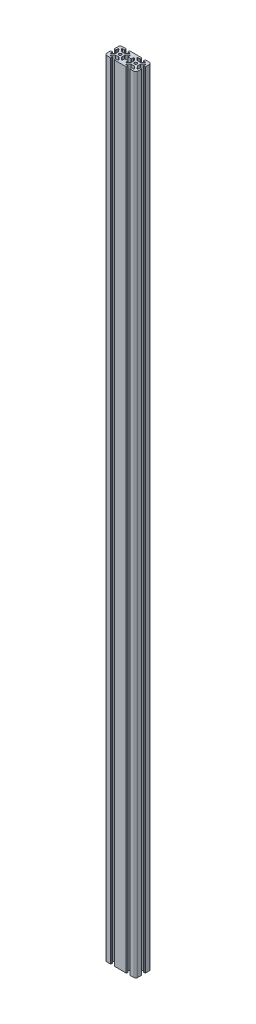
from build123d import *

# Parameters (mm, degrees)
BOSS_EXTRUDE1_DEPTH   = 2016
SKETCH3_R             = 3.4
CUT_EXTRUDE1_DEPTH    = 2018.983151565
CUT_EXTRUDE2_DEPTH    = 2018.983151565
FILLET1_R             = 1
FILLET2_R             = 1
FILLET3_R             = 1
CUT_EXTRUDE3_DEPTH    = 2018.983151565
CUT_EXTRUDE4_DEPTH    = 2018.983151565
FILLET4_R             = 1
FILLET5_R             = 1
FILLET6_R             = 1
FILLET7_R             = 1
FILLET8_R             = 1
FILLET9_R             = 1
FILLET10_R            = 1
FILLET11_R            = 1
MIRROR11_COPY_1_DEPTH = 2018.983151565
MIRROR11_COPY_2_DEPTH = 2018.983151565
CUT_EXTRUDE5_DEPTH    = 1000


with BuildPart() as part:
    # Sketch1 → Boss-Extrude1 (new body)
    with BuildSketch(Plane(origin=(0, 0, 0), x_dir=(1, 0, 0), z_dir=(0, 1, 0))):
        with BuildLine():
            Line((5, 0), (75, 0))
            ThreePointArc((75, 0), (78.535533906, -1.464466094), (80, -5))
            Line((80, -5), (80, -35))
            ThreePointArc((80, -35), (78.535533906, -38.535533906), (75, -40))
            Line((75, -40), (5, -40))
            ThreePointArc((5, -40), (1.464466094, -38.535533906), (0, -35))
            Line((0, -35), (0, -5))
            ThreePointArc((0, -5), (1.464466094, -1.464466094), (5, 0))
        make_face()
    extrude(amount=BOSS_EXTRUDE1_DEPTH)

    # Sketch3 → Cut-Extrude1 (cut, through all)
    with BuildSketch(Plane(origin=(0, 2016, 0), x_dir=(1, 0, 0), z_dir=(0, 1, 0))):
        with Locations(Location((20, -20, 0), (0, 0, 270))):
            Circle(SKETCH3_R)
    cut_extrude1 = extrude(amount=-CUT_EXTRUDE1_DEPTH, mode=Mode.SUBTRACT)

    # Mirror3: Cut-Extrude1 across plane
    add(cut_extrude1.mirror(Plane(origin=(40, 0, 0), x_dir=(0, 0, 1), z_dir=(1, 0, 0))), mode=Mode.SUBTRACT)

    # Sketch7 → Cut-Extrude2 (cut, through all)
    with BuildSketch(Plane(origin=(0, 0, 0), x_dir=(-1, 0, 0), z_dir=(0, -1, 0))):
        with BuildLine():
            Line((-15.9, -40), (-24.1, -40))
            Line((-24.1, -40), (-24.1, -36.5))
            ThreePointArc((-24.1, -36.5), (-24.392893219, -35.792893219), (-25.1, -35.5))
            Line((-25.1, -35.5), (-29.489753594, -35.5))
            ThreePointArc((-29.489753594, -35.5), (-30.415270825, -34.8787055), (-30.190750526, -33.786835712))
            Line((-30.190750526, -33.786835712), (-24.391814382, -28.086835712))
            ThreePointArc((-24.391814382, -28.086835712), (-24.069522951, -27.874482769), (-23.69081745, -27.8))
            Line((-23.69081745, -27.8), (-16.309186536, -27.8))
            ThreePointArc((-16.309186536, -27.8), (-15.930477876, -27.874484063), (-15.608184734, -28.086840499))
            Line((-15.608184734, -28.086840499), (-9.809327805, -33.786840499))
            ThreePointArc((-9.809327805, -33.786840499), (-9.584813669, -34.87870866), (-10.510329607, -35.5))
            Line((-10.510329607, -35.5), (-14.9, -35.5))
            ThreePointArc((-14.9, -35.5), (-15.607106781, -35.792893219), (-15.9, -36.5))
            Line((-15.9, -36.5), (-15.9, -40))
        make_face()
    cut_extrude2 = extrude(amount=-CUT_EXTRUDE2_DEPTH, mode=Mode.SUBTRACT)

    # Fillet1
    fillet1_edges = [part.edges().sort_by_distance(p)[0] for p in [
        (15.9, 1008, 40),
        (24.1, 1008, 40),
    ]]
    fillet(fillet1_edges, radius=FILLET1_R)

    # Mirror8: Cut-Extrude2 across plane
    add(cut_extrude2.mirror(Plane(origin=(40, 0, 0), x_dir=(0, 0, 1), z_dir=(1, 0, 0))), mode=Mode.SUBTRACT)

    # Fillet2
    fillet2_edges = [part.edges().sort_by_distance(p)[0] for p in [
        (55.9, 1008, 40),
    ]]
    fillet(fillet2_edges, radius=FILLET2_R)

    # Fillet3
    fillet3_edges = [part.edges().sort_by_distance(p)[0] for p in [
        (64.1, 1008, 40),
    ]]
    fillet(fillet3_edges, radius=FILLET3_R)

    # Sketch9 → Cut-Extrude3 (cut, through all)
    with BuildSketch(Plane(origin=(0, 0, 0), x_dir=(1, 0, 0), z_dir=(0, 1, 0))):
        with BuildLine():
            Line((14.899846923, -4.500713815), (10.450461284, -4.500713815))
            ThreePointArc((10.450461284, -4.500713815), (9.526581751, -5.118030383), (9.743354502, -6.207820596))
            Line((9.743354502, -6.207820596), (15.442640687, -11.907106781))
            ThreePointArc((15.442640687, -11.907106781), (15.767064036, -12.123879533), (16.149747468, -12.2))
            Line((16.149747468, -12.2), (23.850252532, -12.2))
            ThreePointArc((23.850252532, -12.2), (24.232935964, -12.123879533), (24.557359313, -11.907106781))
            Line((24.557359313, -11.907106781), (30.257359313, -6.207106781))
            ThreePointArc((30.257359313, -6.207106781), (30.474132064, -5.117316568), (29.550252532, -4.5))
            Line((29.550252532, -4.5), (25.099846964, -4.5))
            ThreePointArc((25.099846964, -4.5), (24.392724723, -4.207091321), (24.099846965, -3.499956273))
            Line((24.099846965, -3.499956273), (24.100000008, 0))
            Line((24.100000008, 0), (15.9, 0))
            Line((15.9, 0), (15.899846922, -3.500757542))
            ThreePointArc((15.899846922, -3.500757542), (15.606938244, -4.207836056), (14.899846923, -4.500713815))
        make_face()
    cut_extrude3 = extrude(amount=CUT_EXTRUDE3_DEPTH, mode=Mode.SUBTRACT)

    # Mirror9: Cut-Extrude3 across plane
    add(cut_extrude3.mirror(Plane(origin=(40, 0, 0), x_dir=(0, 0, 1), z_dir=(1, 0, 0))), mode=Mode.SUBTRACT)

    # Sketch10 → Cut-Extrude4 (cut, through all)
    with BuildSketch(Plane(origin=(0, 0, 0), x_dir=(1, 0, 0), z_dir=(0, 1, 0))):
        with BuildLine():
            Line((4.5, -14.9), (4.5, -10.58605332))
            ThreePointArc((4.5, -10.58605332), (5.126159695, -9.658560233), (6.220486853, -9.892584724))
            Line((6.220486853, -9.892584724), (11.920486853, -15.814662646))
            ThreePointArc((11.920486853, -15.814662646), (12.127493087, -16.134290938), (12.2, -16.508131242))
            Line((12.2, -16.508131242), (12.2, -23.491868758))
            ThreePointArc((12.2, -23.491868758), (12.127493087, -23.865709062), (11.920486853, -24.185337354))
            Line((11.920486853, -24.185337354), (6.220486853, -30.107415276))
            ThreePointArc((6.220486853, -30.107415276), (5.126159695, -30.341439767), (4.5, -29.41394668))
            Line((4.5, -29.41394668), (4.5, -25.1))
            ThreePointArc((4.5, -25.1), (4.207106781, -24.392893219), (3.5, -24.1))
            Line((3.5, -24.1), (0, -24.1))
            Line((0, -24.1), (0, -15.9))
            Line((0, -15.9), (3.5, -15.9))
            ThreePointArc((3.5, -15.9), (4.207106781, -15.607106781), (4.5, -14.9))
        make_face()
    cut_extrude4 = extrude(amount=CUT_EXTRUDE4_DEPTH, mode=Mode.SUBTRACT)

    # Fillet4
    fillet4_edges = [part.edges().sort_by_distance(p)[0] for p in [
        (24.100000008, 1008, 0),
    ]]
    fillet(fillet4_edges, radius=FILLET4_R)

    # Fillet5
    fillet5_edges = [part.edges().sort_by_distance(p)[0] for p in [
        (64.1, 1008, 0),
    ]]
    fillet(fillet5_edges, radius=FILLET5_R)

    # Fillet6
    fillet6_edges = [part.edges().sort_by_distance(p)[0] for p in [
        (55.899999992, 1008, 0),
    ]]
    fillet(fillet6_edges, radius=FILLET6_R)

    # Fillet7
    fillet7_edges = [part.edges().sort_by_distance(p)[0] for p in [
        (15.9, 1008, 0),
    ]]
    fillet(fillet7_edges, radius=FILLET7_R)

    # Fillet8
    fillet8_edges = [part.edges().sort_by_distance(p)[0] for p in [
        (0, 1008, 24.1),
    ]]
    fillet(fillet8_edges, radius=FILLET8_R)

    # Fillet9
    fillet9_edges = [part.edges().sort_by_distance(p)[0] for p in [
        (0, 1008, 15.9),
    ]]
    fillet(fillet9_edges, radius=FILLET9_R)

    # Mirror10: Cut-Extrude4 across plane
    add(cut_extrude4.mirror(Plane(origin=(40, 0, 0), x_dir=(0, 0, 1), z_dir=(1, 0, 0))), mode=Mode.SUBTRACT)

    # Fillet10
    fillet10_edges = [part.edges().sort_by_distance(p)[0] for p in [
        (80, 1008, 15.9),
    ]]
    fillet(fillet10_edges, radius=FILLET10_R)

    # Fillet11
    fillet11_edges = [part.edges().sort_by_distance(p)[0] for p in [
        (80, 1008, 24.1),
    ]]
    fillet(fillet11_edges, radius=FILLET11_R)

    # Mirror11 copy 1 sketch → Mirror11 copy 1 (cut, through all)
    with BuildSketch(Plane(origin=(40, 0, 0), x_dir=(1, 0, 0), z_dir=(0, 1, 0))):
        with BuildLine():
            Line((4.5, -14.9), (4.5, -10.58605332))
            ThreePointArc((4.5, -10.58605332), (5.126159695, -9.658560233), (6.220486853, -9.892584724))
            Line((6.220486853, -9.892584724), (11.920486853, -15.814662646))
            ThreePointArc((11.920486853, -15.814662646), (12.127493087, -16.134290938), (12.2, -16.508131242))
            Line((12.2, -16.508131242), (12.2, -23.491868758))
            ThreePointArc((12.2, -23.491868758), (12.127493087, -23.865709062), (11.920486853, -24.185337354))
            Line((11.920486853, -24.185337354), (6.220486853, -30.107415276))
            ThreePointArc((6.220486853, -30.107415276), (5.126159695, -30.341439767), (4.5, -29.41394668))
            Line((4.5, -29.41394668), (4.5, -25.1))
            ThreePointArc((4.5, -25.1), (4.207106781, -24.392893219), (3.5, -24.1))
            Line((3.5, -24.1), (0, -24.1))
            Line((0, -24.1), (0, -15.9))
            Line((0, -15.9), (3.5, -15.9))
            ThreePointArc((3.5, -15.9), (4.207106781, -15.607106781), (4.5, -14.9))
        make_face()
    extrude(amount=MIRROR11_COPY_1_DEPTH, mode=Mode.SUBTRACT)

    # Mirror11 copy 2 sketch → Mirror11 copy 2 (cut, through all)
    with BuildSketch(Plane(origin=(120, 0, 0), x_dir=(-1, 0, 0), z_dir=(0, 1, 0))):
        with BuildLine():
            Line((4.5, 14.9), (4.5, 10.58605332))
            ThreePointArc((4.5, 10.58605332), (5.126159695, 9.658560233), (6.220486853, 9.892584724))
            Line((6.220486853, 9.892584724), (11.920486853, 15.814662646))
            ThreePointArc((11.920486853, 15.814662646), (12.127493087, 16.134290938), (12.2, 16.508131242))
            Line((12.2, 16.508131242), (12.2, 23.491868758))
            ThreePointArc((12.2, 23.491868758), (12.127493087, 23.865709062), (11.920486853, 24.185337354))
            Line((11.920486853, 24.185337354), (6.220486853, 30.107415276))
            ThreePointArc((6.220486853, 30.107415276), (5.126159695, 30.341439767), (4.5, 29.41394668))
            Line((4.5, 29.41394668), (4.5, 25.1))
            ThreePointArc((4.5, 25.1), (4.207106781, 24.392893219), (3.5, 24.1))
            Line((3.5, 24.1), (0, 24.1))
            Line((0, 24.1), (0, 15.9))
            Line((0, 15.9), (3.5, 15.9))
            ThreePointArc((3.5, 15.9), (4.207106781, 15.607106781), (4.5, 14.9))
        make_face()
    extrude(amount=MIRROR11_COPY_2_DEPTH, mode=Mode.SUBTRACT)

    # Mirror12: Cut-Extrude4 across plane
    add(cut_extrude4.mirror(Plane.ZY.offset(-20)), mode=Mode.SUBTRACT)

    # Sketch12 → Cut-Extrude5 (cut)
    with BuildSketch(Plane(origin=(0, 0, 0), x_dir=(-1, 0, 0), z_dir=(0, -1, 0))):
        with BuildLine():
            Line((-28.079513147, -24.185337354), (-39.327067998, -35.871108628))
            ThreePointArc((-39.327067998, -35.871108628), (-40.049082116, -36.177638866), (-40.770156561, -35.868904648))
            Line((-40.770156561, -35.868904648), (-51.922601709, -24.210885791))
            ThreePointArc((-51.922601709, -24.210885791), (-52.128062958, -23.892044517), (-52.2, -23.519621175))
            Line((-52.2, -23.519621175), (-52.2, -16.508131242))
            ThreePointArc((-52.2, -16.508131242), (-52.127493087, -16.134290938), (-51.920486853, -15.814662646))
            Line((-51.920486853, -15.814662646), (-40.720486853, -4.17829901))
            ThreePointArc((-40.720486853, -4.17829901), (-40, -3.871767606), (-39.279513147, -4.17829901))
            Line((-39.279513147, -4.17829901), (-28.079513147, -15.814662646))
            ThreePointArc((-28.079513147, -15.814662646), (-27.872506913, -16.134290938), (-27.8, -16.508131242))
            Line((-27.8, -16.508131242), (-27.8, -23.491868758))
            ThreePointArc((-27.8, -23.491868758), (-27.872506913, -23.865709062), (-28.079513147, -24.185337354))
        make_face()
    extrude(amount=-CUT_EXTRUDE5_DEPTH, mode=Mode.SUBTRACT)


solid = part.part
